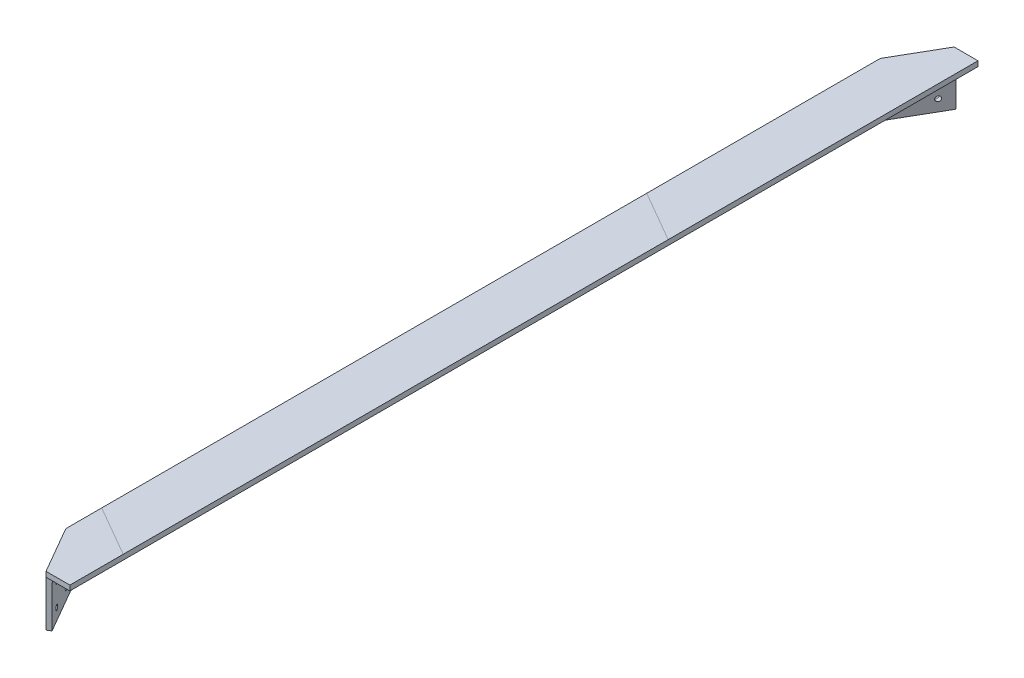
from build123d import *

# Parameters (mm, degrees)
BOSS_EXTRUDE1_DEPTH  = 640
BOSS_EXTRUDE2_DEPTH  = 8
BOSS_EXTRUDE3_DEPTH  = 72
SKETCH6_R            = 4
CUT_EXTRUDE1_DEPTH   = 8
FILLET1_R            = 10
FILLET2_R            = 8
FILLET1_OF_MIRROR1_R = 10
FILLET2_OF_MIRROR1_R = 8


with BuildPart() as part:
    # Sketch1 → Boss-Extrude1 (new body)
    with BuildSketch(Plane.XY):
        Polygon((-8, 8), (72, 8), (72, 0), (0, 0), (0, -72), (-8, -72), align=None)
    boss_extrude1 = extrude(amount=BOSS_EXTRUDE1_DEPTH)

    # Sketch3 → Boss-Extrude2 (add)
    with BuildSketch(Plane(origin=(0, 0, 0), x_dir=(1, 0, 0), z_dir=(0, 1, 0))):
        Polygon((-8, -640), (34.5, -713.612159322), (72, -713.612159322), (72, -640), align=None)
    boss_extrude2 = extrude(amount=BOSS_EXTRUDE2_DEPTH)

    # Sketch4 → Boss-Extrude3 (add)
    with BuildSketch(Plane.XZ):
        Polygon((-8, 640), (34.5, 713.612159322), (40.5, 710.148057707), (0, 640), align=None)
    boss_extrude3 = extrude(amount=BOSS_EXTRUDE3_DEPTH)

    # Sketch6 → Cut-Extrude1 (cut)
    with BuildSketch(Plane(origin=(-277.128129211, 0, 160), x_dir=(-0.4999999999999956, 0, -0.8660254037844413), z_dir=(0.8660254037844413, 0, -0.4999999999999956))):
        with Locations((-615.006258422, -18)):
            Circle(SKETCH6_R)
        with Locations((-574.506258422, -18)):
            Circle(SKETCH6_R)
        with Locations((-574.506258422, -54)):
            Circle(SKETCH6_R)
        with Locations((-615.006258422, -54)):
            Circle(SKETCH6_R)
    cut_extrude1 = extrude(amount=-CUT_EXTRUDE1_DEPTH, mode=Mode.SUBTRACT)

    # Fillet1
    fillet1_edges = [part.edges().sort_by_distance(p)[0] for p in [
        (0, -36, 640),
        (-8, -32, 640),
    ]]
    fillet(fillet1_edges, radius=FILLET1_R)

    # Fillet2
    fillet2_edges = [part.edges().sort_by_distance(p)[0] for p in [
        (20.919872981, 0, 676.234282891),
        (0, 0, 318.660254038),
        (0.340741737, 0, 639.908698527),
    ]]
    fillet(fillet2_edges, radius=FILLET2_R)

    # Mirror1: Boss-Extrude1, Boss-Extrude2, Boss-Extrude3, Cut-Extrude1 across plane
    add(boss_extrude1.mirror(Plane.XY))
    add(boss_extrude2.mirror(Plane.XY))
    add(boss_extrude3.mirror(Plane.XY))
    add(cut_extrude1.mirror(Plane.XY), mode=Mode.SUBTRACT)

    # Fillet1 of Mirror1
    fillet1_of_mirror1_edges = [part.edges().sort_by_distance(p)[0] for p in [
        (0, -36, -640),
        (-8, -32, -640),
    ]]
    fillet(fillet1_of_mirror1_edges, radius=FILLET1_OF_MIRROR1_R)

    # Fillet2 of Mirror1
    fillet2_of_mirror1_edges = [part.edges().sort_by_distance(p)[0] for p in [
        (20.919872981, 0, -676.234282891),
        (0, 0, -318.660254038),
        (0.340741737, 0, -639.908698527),
    ]]
    fillet(fillet2_of_mirror1_edges, radius=FILLET2_OF_MIRROR1_R)


solid = part.part
